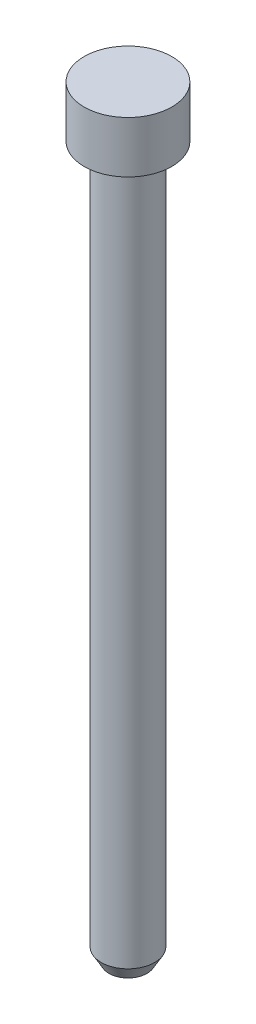
from build123d import *

# Parameters (mm, degrees)
SKETCH1_R           = 2.6
BOSS_EXTRUDE1_DEPTH = 69
SKETCH2_R           = 4.25
BOSS_EXTRUDE2_DEPTH = 5
FILLET1_R           = 0.5
CHAMFER1_SIZE       = 0.75
CHAMFER1_SIZE2      = 1.299038106


with BuildPart() as part:
    # Sketch1 → Boss-Extrude1 (new body)
    with BuildSketch(Plane(origin=(0, 0, 0), x_dir=(1, 0, 0), z_dir=(0, 1, 0))):
        with Locations(Location((0, 0, 0), (0, 0, 270))):
            Circle(SKETCH1_R)
    extrude(amount=BOSS_EXTRUDE1_DEPTH)

    # Sketch2 → Boss-Extrude2 (add)
    with BuildSketch(Plane(origin=(0, 69, 0), x_dir=(1, 0, 0), z_dir=(0, 1, 0))):
        with Locations(Location((0, 0, 0), (0, 0, 270))):
            Circle(SKETCH2_R)
    extrude(amount=BOSS_EXTRUDE2_DEPTH)

    # Fillet1
    fillet1_edges = [part.edges().sort_by_distance(p)[0] for p in [
        (0, 69, -2.6),
    ]]
    fillet(fillet1_edges, radius=FILLET1_R)

    # Chamfer1
    chamfer1_edges = [part.edges().sort_by_distance(p)[0] for p in [
        (0, 0, -2.6),
    ]]
    chamfer1_side = [part.faces().sort_by_distance(p)[0] for p in [
        (0, 0, 0),
    ]]
    chamfer(chamfer1_edges, length=CHAMFER1_SIZE, length2=CHAMFER1_SIZE2, reference=chamfer1_side[0])


solid = part.part
